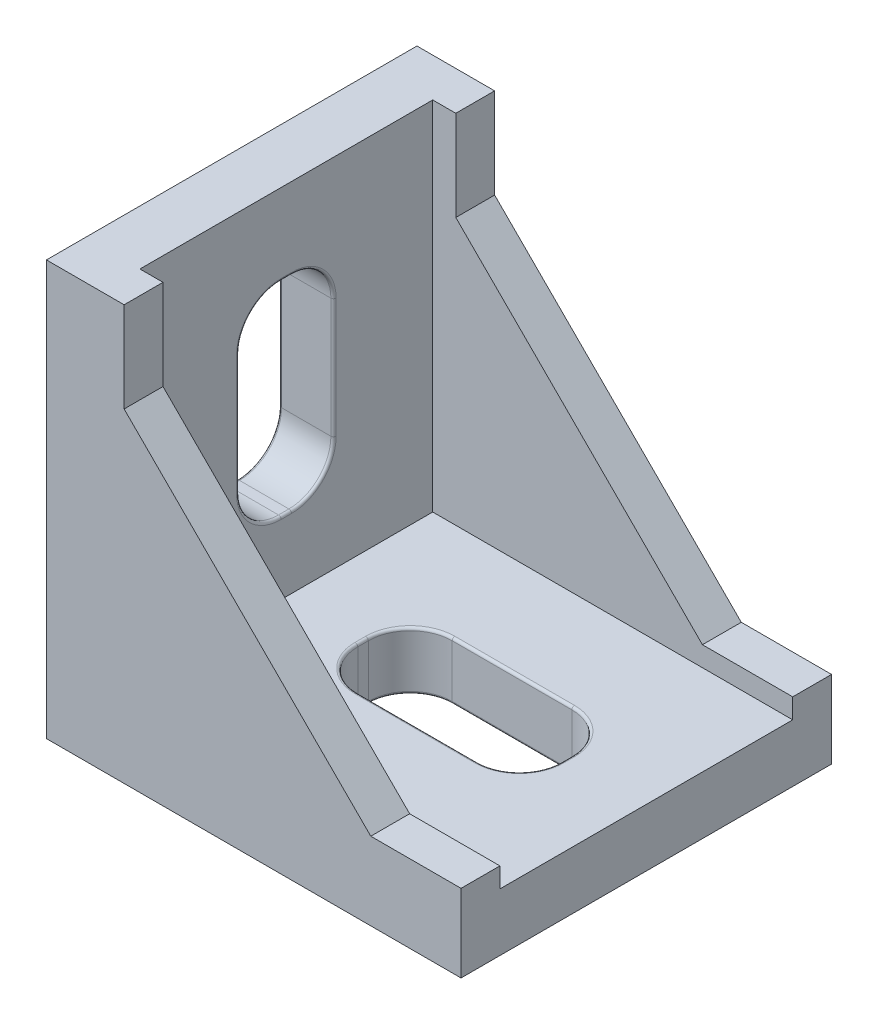
from build123d import *

# Parameters (mm, degrees)
BOSS_EXTRU_1_DEPTH      = 35.3
ESQUISSE2_W             = 34.2976806
ESQUISSE2_H             = 27.8959906
ENL_V_MAT_EXTRU_1_DEPTH = 34
ENL_V_MAT_EXTRU_5_DEPTH = 34
CONG_1_R                = 0.25
ENL_V_MAT_EXTRU_6_DEPTH = 34
CONG_2_R                = 0.25
BOSS_EXTRU_2_DEPTH      = 2
CHANFREIN1_SIZE         = 1.5
ESQUISSE6_W             = 3.622795385
ESQUISSE6_H             = 7.9
BOSS_EXTRU_4_DEPTH      = 2
CHANFREIN2_SIZE         = 1.5
ESQUISSE7_W             = 7.85
ESQUISSE7_H             = 4.6
ESQUISSE7_H_2           = 4.604428761
BOSS_EXTRU_5_DEPTH      = 2
CHANFREIN3_SIZE         = 1.5


with BuildPart() as part:
    # Esquisse1 → Boss.-Extru.1 (new body)
    with BuildSketch(Plane.XY):
        Polygon((0, 0), (39.5, 0), (39.5, 7.4), (30.9, 7.4), (7.4, 30.9), (7.4, 39.5), (0, 39.5), align=None)
    extrude(amount=-BOSS_EXTRU_1_DEPTH)

    # Esquisse2 → Enlèv. mat.-Extru.1 (cut)
    with BuildSketch(Plane(origin=(0, 39.5, 0), x_dir=(1, 0, 0), z_dir=(0, 1, 0))):
        with Locations((22.3511597, 17.6520047)):
            Rectangle(ESQUISSE2_W, ESQUISSE2_H)
    extrude(amount=-ENL_V_MAT_EXTRU_1_DEPTH, mode=Mode.SUBTRACT)

    # Esquisse3 → Enlèv. mat.-Extru.5 (cut)
    with BuildSketch(Plane(origin=(5.2023194, 0, 0), x_dir=(0, 0, -1), z_dir=(1, 0, 0))):
        with BuildLine():
            Line((18.147028677, 12.354666202), (17.156980723, 12.354666202))
            ThreePointArc((17.156980723, 12.354666202), (14.328553598, 13.526239077), (13.156980723, 16.354666202))
            Line((13.156980723, 16.354666202), (13.156980723, 27.748298541))
            ThreePointArc((13.156980723, 27.748298541), (14.328553598, 30.576725666), (17.156980723, 31.748298541))
            Line((17.156980723, 31.748298541), (18.147028677, 31.748298541))
            ThreePointArc((18.147028677, 31.748298541), (20.975455802, 30.576725666), (22.147028677, 27.748298541))
            Line((22.147028677, 27.748298541), (22.147028677, 16.354666202))
            ThreePointArc((22.147028677, 16.354666202), (20.975455802, 13.526239077), (18.147028677, 12.354666202))
        make_face()
    extrude(amount=-ENL_V_MAT_EXTRU_5_DEPTH, mode=Mode.SUBTRACT)

    # Congé1
    cong_1_edges = [part.edges().sort_by_distance(p)[0] for p in [
        (0, 13.526239077, -20.975455802),
        (0, 12.354666202, -17.6520047),
        (0, 13.526239077, -14.328553598),
        (0, 22.051482371, -13.156980723),
        (0, 30.576725666, -14.328553598),
        (0, 31.748298541, -17.6520047),
        (0, 30.576725666, -20.975455802),
        (0, 22.051482371, -22.147028677),
        (5.2023194, 13.526239077, -20.975455802),
        (5.2023194, 22.051482371, -22.147028677),
        (5.2023194, 30.576725666, -20.975455802),
        (5.2023194, 31.748298541, -17.6520047),
        (5.2023194, 30.576725666, -14.328553598),
        (5.2023194, 22.051482371, -13.156980723),
        (5.2023194, 13.526239077, -14.328553598),
        (5.2023194, 12.354666202, -17.6520047),
    ]]
    fillet(cong_1_edges, radius=CONG_1_R)

    # Esquisse4 → Enlèv. mat.-Extru.6 (cut)
    with BuildSketch(Plane(origin=(0, 5.5, 0), x_dir=(1, 0, 0), z_dir=(0, 1, 0))):
        with BuildLine():
            Line((12.508316826, 17.151207911), (12.508316826, 18.152801489))
            ThreePointArc((12.508316826, 18.152801489), (13.679889701, 20.981228614), (16.508316826, 22.152801489))
            Line((16.508316826, 22.152801489), (27.901153551, 22.152801489))
            ThreePointArc((27.901153551, 22.152801489), (30.729580676, 20.981228614), (31.901153551, 18.152801489))
            Line((31.901153551, 18.152801489), (31.901153551, 17.151207911))
            ThreePointArc((31.901153551, 17.151207911), (30.729580676, 14.322780786), (27.901153551, 13.151207911))
            Line((27.901153551, 13.151207911), (16.508316826, 13.151207911))
            ThreePointArc((16.508316826, 13.151207911), (13.679889701, 14.322780786), (12.508316826, 17.151207911))
        make_face()
    extrude(amount=-ENL_V_MAT_EXTRU_6_DEPTH, mode=Mode.SUBTRACT)

    # Congé2
    cong_2_edges = [part.edges().sort_by_distance(p)[0] for p in [
        (30.729580676, 0, -20.981228614),
        (31.901153551, 0, -17.6520047),
        (30.729580676, 0, -14.322780786),
        (22.204735188, 0, -13.151207911),
        (13.679889701, 0, -14.322780786),
        (12.508316826, 0, -17.6520047),
        (13.679889701, 0, -20.981228614),
        (22.204735188, 0, -22.152801489),
        (30.729580676, 5.5, -20.981228614),
        (22.204735188, 5.5, -22.152801489),
        (13.679889701, 5.5, -20.981228614),
        (12.508316826, 5.5, -17.6520047),
        (13.679889701, 5.5, -14.322780786),
        (22.204735188, 5.5, -13.151207911),
        (30.729580676, 5.5, -14.322780786),
        (31.901153551, 5.5, -17.6520047),
    ]]
    fillet(cong_2_edges, radius=CONG_2_R)

    # Esquisse5 → Boss.-Extru.2 (add)
    with BuildSketch(Plane.XZ):
        Polygon((3.598003918, -17.650224344), (3.598003918, -21.575224344), (7.598003918, -21.575224344), (7.598003918, -17.650473753), (7.598493353, -13.725723193), (3.598493384, -13.725224375), align=None)
    extrude(amount=BOSS_EXTRU_2_DEPTH)

    # Chanfrein1
    chanfrein1_edges = [part.edges().sort_by_distance(p)[0] for p in [
        (7.598248636, -2, -15.688098473),
        (3.598248651, -2, -15.687724359),
        (3.598003918, -2, -19.612724344),
        (7.598003918, -2, -19.612849049),
    ]]
    chamfer(chanfrein1_edges, length=CHANFREIN1_SIZE)

    # Esquisse6 → Boss.-Extru.4 (add)
    with BuildSketch(Plane.XZ):
        with Locations((34.084238676, -17.625224344)):
            Rectangle(ESQUISSE6_W, ESQUISSE6_H)
    extrude(amount=BOSS_EXTRU_4_DEPTH)

    # Chanfrein2
    chanfrein2_edges = [part.edges().sort_by_distance(p)[0] for p in [
        (35.895636368, -2, -17.625224344),
        (32.272840983, -2, -17.625224344),
    ]]
    chamfer(chanfrein2_edges, length=CHANFREIN2_SIZE)

    # Esquisse7 → Boss.-Extru.5 (add)
    with BuildSketch(Plane.ZY):
        with Locations((-17.650224344, 5.512563988)):
            Rectangle(ESQUISSE7_W, ESQUISSE7_H)
        with Locations((-17.650224344, 35.099755073)):
            Rectangle(ESQUISSE7_W, ESQUISSE7_H_2)
    extrude(amount=BOSS_EXTRU_5_DEPTH)

    # Chanfrein3
    chanfrein3_edges = [part.edges().sort_by_distance(p)[0] for p in [
        (-2, 7.812563988, -17.650224344),
        (-2, 3.212563988, -17.650224344),
        (-2, 37.401969453, -17.650224344),
        (-2, 32.797540692, -17.650224344),
    ]]
    chamfer(chanfrein3_edges, length=CHANFREIN3_SIZE)


solid = part.part
